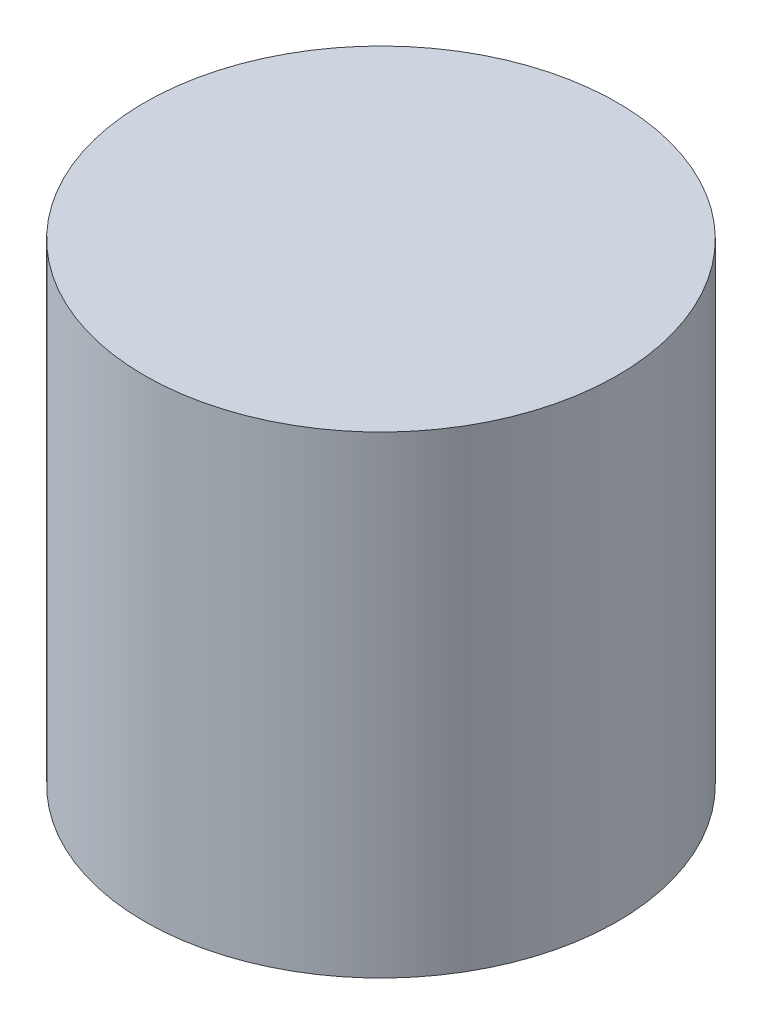
from build123d import *

# Parameters (mm, degrees)
SKETCH1_R           = 18
BOSS_EXTRUDE1_DEPTH = 36


with BuildPart() as part:
    # Sketch1 → Boss-Extrude1 (new body)
    with BuildSketch(Plane(origin=(0, 0, 0), x_dir=(1, 0, 0), z_dir=(0, 1, 0))):
        with Locations(Location((0, 0, 0), (0, 0, 270))):
            Circle(SKETCH1_R)
    extrude(amount=BOSS_EXTRUDE1_DEPTH)


solid = part.part
